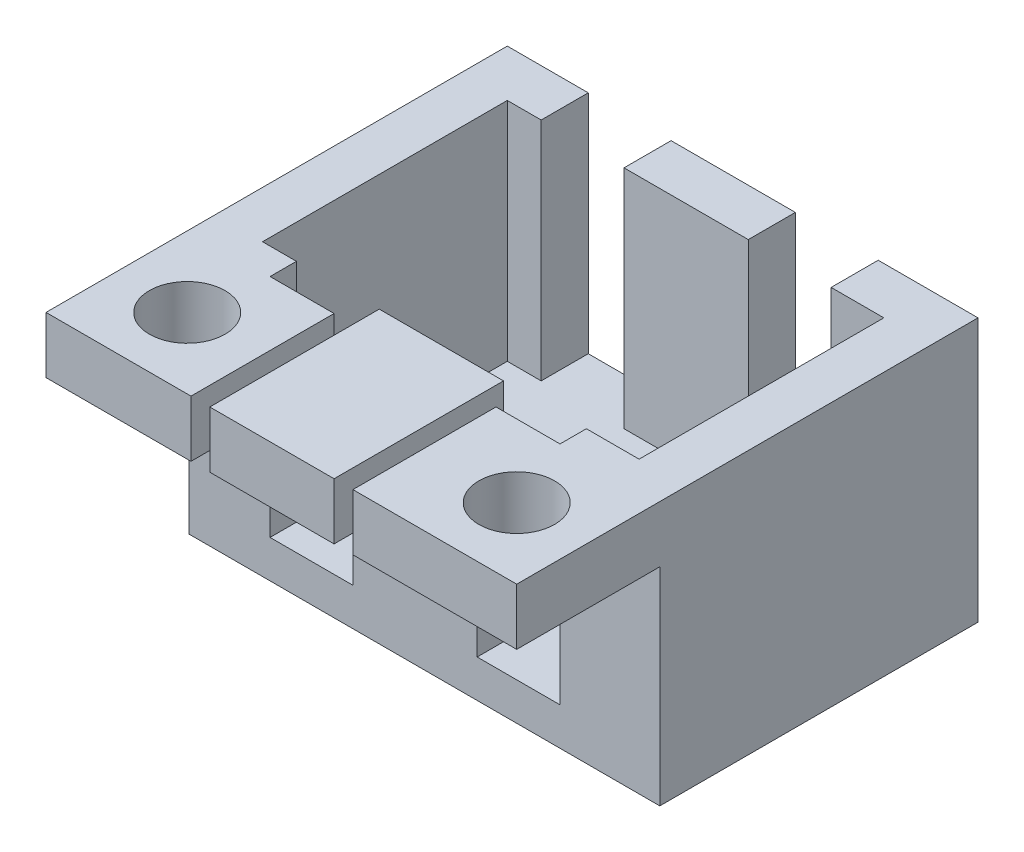
from build123d import *

# Parameters (mm, degrees)
SKETCH1_W              = 31.75
SKETCH1_H              = 21.463
PLATE_DEPTH            = 1.27
SKETCH4_W              = 31.75
SKETCH4_H              = 15.24
BOSS_EXTRUDE1_DEPTH    = 1.778
SKETCH5_W              = 3.175
SKETCH5_H              = 15.24
BOSS_EXTRUDE2_DEPTH    = 19.685
BOSS_EXTRUDE5_REACH    = 36.703
SKETCH9_W              = 3.175
SKETCH9_H              = 15.24
SKETCH11_W             = 5.588
SKETCH11_H             = 15.24
CUT_EXTRUDE1_DEPTH     = 32.388789304
SKETCH13_W             = 31.75
SKETCH13_H             = 3.81
BOSS_EXTRUDE7_DEPTH    = 9.652
F_10_CLEARANCE_HOLE1_D = 5.1054
SKETCH18_W             = 1.27
SKETCH18_H             = 9.652
CUT_EXTRUDE6_DEPTH     = 32.362893636


with BuildPart() as part:
    # Sketch1 → Plate (new, symmetric)
    with BuildSketch(Plane(origin=(0, 0, 0), x_dir=(1, 0, 0), z_dir=(0, 1, 0))):
        Rectangle(SKETCH1_W, SKETCH1_H)
    extrude(amount=PLATE_DEPTH, both=True)

    # Sketch4 → Boss-Extrude1 (add)
    with BuildSketch(Plane.XY.offset(10.7315)):
        with Locations((0, 8.89)):
            Rectangle(SKETCH4_W, SKETCH4_H)
    extrude(amount=-BOSS_EXTRUDE1_DEPTH)

    # Sketch5 → Boss-Extrude2 (add)
    with BuildSketch(Plane(origin=(0, 0, 8.9535), x_dir=(-1, 0, 0), z_dir=(0, 0, -1))):
        with Locations((-14.2875, 8.89)):
            Rectangle(SKETCH5_W, SKETCH5_H)
        with Locations((14.2875, 8.89)):
            Rectangle(SKETCH5_W, SKETCH5_H)
    extrude(amount=BOSS_EXTRUDE2_DEPTH)

    # Sketch9 → Boss-Extrude5 (add, up to next)
    with BuildSketch(Plane.ZY.offset(-12.7), mode=Mode.PRIVATE) as boss_extrude5_sk1:
        with Locations((-9.144, 8.89)):
            Rectangle(SKETCH9_W, SKETCH9_H)
    boss_extrude5_tool1 = extrude(boss_extrude5_sk1.sketch, amount=BOSS_EXTRUDE5_REACH, mode=Mode.PRIVATE) - part.part
    add(boss_extrude5_tool1.solids().sort_by_distance((12.7, 8.89, -9.144))[0])

    # Sketch11 → Cut-Extrude1 (cut, through all)
    with BuildSketch(Plane(origin=(0, 0, -10.7315), x_dir=(-1, 0, 0), z_dir=(0, 0, -1))):
        with Locations((-6.35, 8.89)):
            Rectangle(SKETCH11_W, SKETCH11_H)
        with Locations((7.62, 8.89)):
            Rectangle(SKETCH11_W, SKETCH11_H)
    extrude(amount=-CUT_EXTRUDE1_DEPTH, mode=Mode.SUBTRACT)

    # Sketch13 → Boss-Extrude7 (add)
    with BuildSketch(Plane.XY.offset(10.7315)):
        with Locations((0, 14.605)):
            Rectangle(SKETCH13_W, SKETCH13_H)
    extrude(amount=BOSS_EXTRUDE7_DEPTH)

    # #10 Clearance Hole1 (through all)
    with Locations(Plane(origin=(11.1125, 16.51, 15.621), x_dir=(0, 0, 1), z_dir=(0, 1, 0))):
        with Locations((0, 0), (0, -22.225)):
            Hole(F_10_CLEARANCE_HOLE1_D / 2)

    # Sketch18 → Cut-Extrude6 (cut, through all)
    with BuildSketch(Plane(origin=(0, 16.51, 0), x_dir=(1, 0, 0), z_dir=(0, 1, 0))):
        with Locations((-5.461, -15.5575)):
            Rectangle(SKETCH18_W, SKETCH18_H)
        with Locations((4.191, -15.5575)):
            Rectangle(SKETCH18_W, SKETCH18_H)
    extrude(amount=-CUT_EXTRUDE6_DEPTH, mode=Mode.SUBTRACT)


solid = part.part
